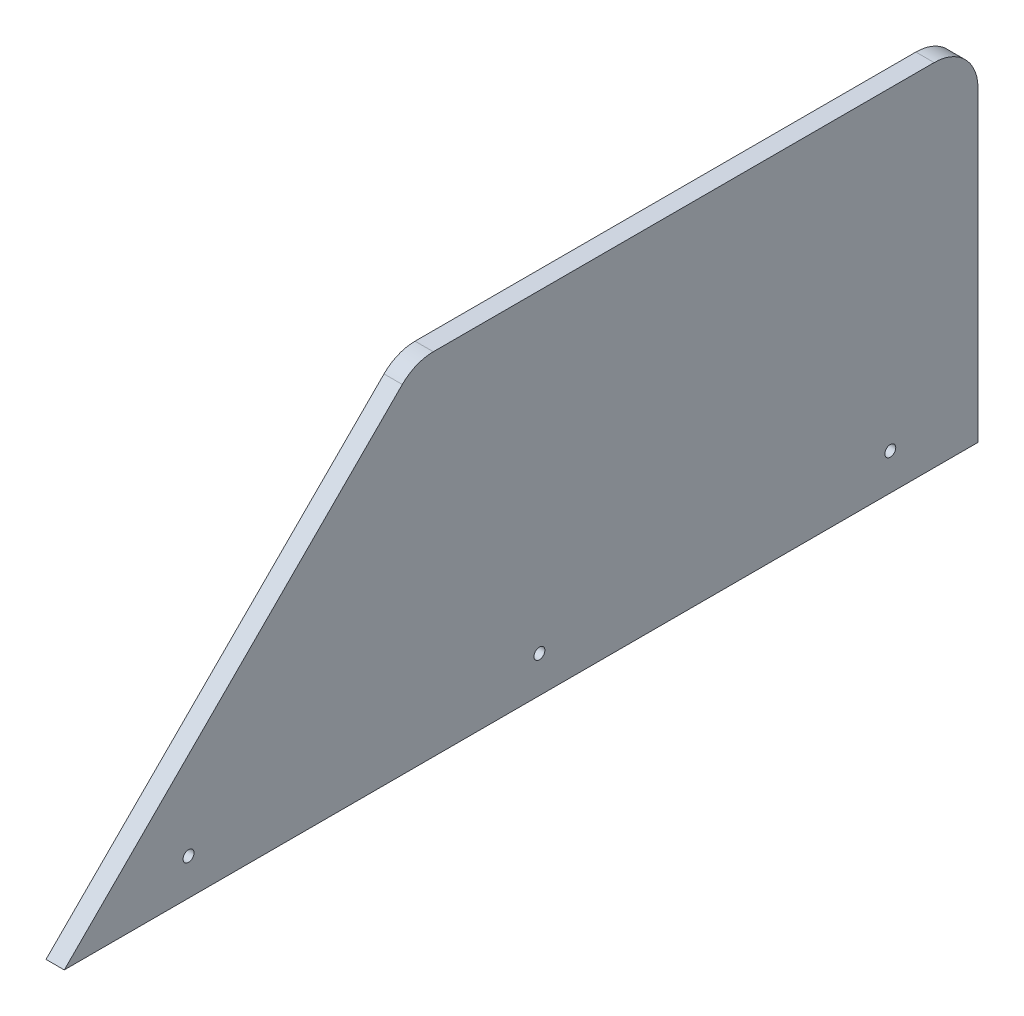
from build123d import *

# Parameters (mm, degrees)
SKETCH1_R           = 1.5
BOSS_EXTRUDE1_DEPTH = 5
FILLET1_R           = 12


with BuildPart() as part:
    # Sketch1 → Boss-Extrude1 (new body)
    with BuildSketch(Plane(origin=(0, 0, 0), x_dir=(0, 0, -1), z_dir=(1, 0, 0))):
        Polygon((0, 0), (0, 96), (-154, 96), (-250, 0), align=None)
        with Locations((-120, 10)):
            Circle(SKETCH1_R, mode=Mode.SUBTRACT)
        with Locations((-24, 10)):
            Circle(SKETCH1_R, mode=Mode.SUBTRACT)
        with Locations((-216, 10)):
            Circle(SKETCH1_R, mode=Mode.SUBTRACT)
    extrude(amount=BOSS_EXTRUDE1_DEPTH)

    # Fillet1
    fillet1_edges = [part.edges().sort_by_distance(p)[0] for p in [
        (2.5, 96, 154),
        (2.5, 96, 0),
    ]]
    fillet(fillet1_edges, radius=FILLET1_R)


solid = part.part
